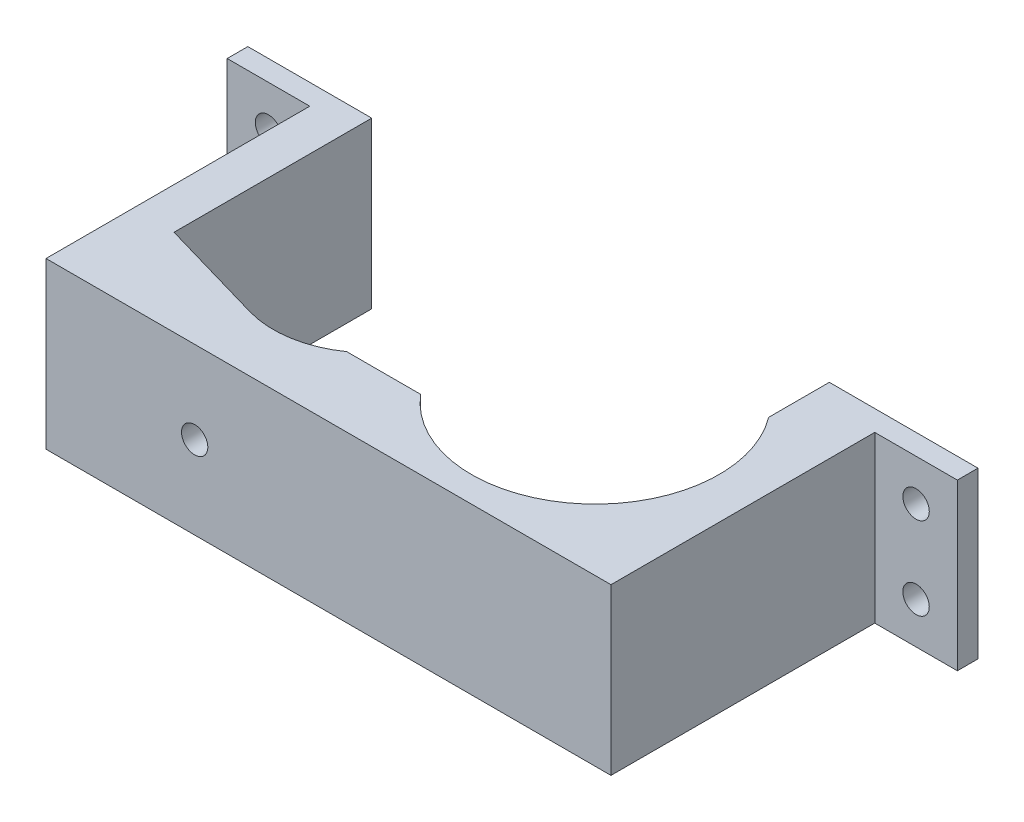
from build123d import *

# Parameters (mm, degrees)
BOSS_EXTRUDE1_DEPTH    = 25.4
SKETCH2_R              = 2.032
CUT_EXTRUDE1_DEPTH     = 87.9904043
F_10_32_TAPPED_HOLE1_D = 4.0386


with BuildPart() as part:
    # Sketch1 → Boss-Extrude1 (new body)
    with BuildSketch(Plane(origin=(0, 0, 0), x_dir=(1, 0, 0), z_dir=(0, 1, 0))):
        with BuildLine():
            Line((-20.574, -9.652129604), (-4.162019583, -14.39674322))
            ThreePointArc((-4.162019583, -14.39674322), (2.459785533, -14.783033433), (8.59971196, -12.273287113))
            Line((8.59971196, -12.273287113), (19.974548279, -12.273287113))
            ThreePointArc((19.974548279, -12.273287113), (46.400384935, -14.910688658), (49.784, 11.43))
            Line((49.784, 11.43), (49.784, 20.746712887))
            Line((49.784, 20.746712887), (72.644, 20.746712887))
            Line((72.644, 20.746712887), (72.644, 17.571712887))
            Line((72.644, 17.571712887), (59.944, 17.571712887))
            Line((59.944, 17.571712887), (59.944, -12.827129604))
            Line((59.944, -12.827129604), (59.944, -22.987129604))
            Line((59.944, -22.987129604), (-26.924, -22.987129604))
            Line((-26.924, -22.987129604), (-26.924, -12.827129604))
            Line((-26.924, -12.827129604), (-26.924, 17.571712887))
            Line((-26.924, 17.571712887), (-39.624, 17.571712887))
            Line((-39.624, 17.571712887), (-39.624, 20.746712887))
            Line((-39.624, 20.746712887), (-20.574, 20.746712887))
            Line((-20.574, 20.746712887), (-20.574, 9.652))
            Line((-20.574, 9.652), (-20.574, -9.652129604))
        make_face()
    extrude(amount=BOSS_EXTRUDE1_DEPTH)

    # Sketch2 → Cut-Extrude1 (cut, through all)
    with BuildSketch(Plane.XY.offset(-17.571712887)):
        with Locations((-33.274, 19.05)):
            Circle(SKETCH2_R)
        with Locations((-33.274, 6.35)):
            Circle(SKETCH2_R)
        with Locations((66.294, 19.05)):
            Circle(SKETCH2_R)
        with Locations((66.294, 6.35)):
            Circle(SKETCH2_R)
    extrude(amount=-CUT_EXTRUDE1_DEPTH, mode=Mode.SUBTRACT)

    # #10-32 Tapped Hole1 (through all)
    with Locations(Plane.XY.offset(22.987129604)):
        with Locations((-4.064, 12.7)):
            Hole(F_10_32_TAPPED_HOLE1_D / 2)


solid = part.part
